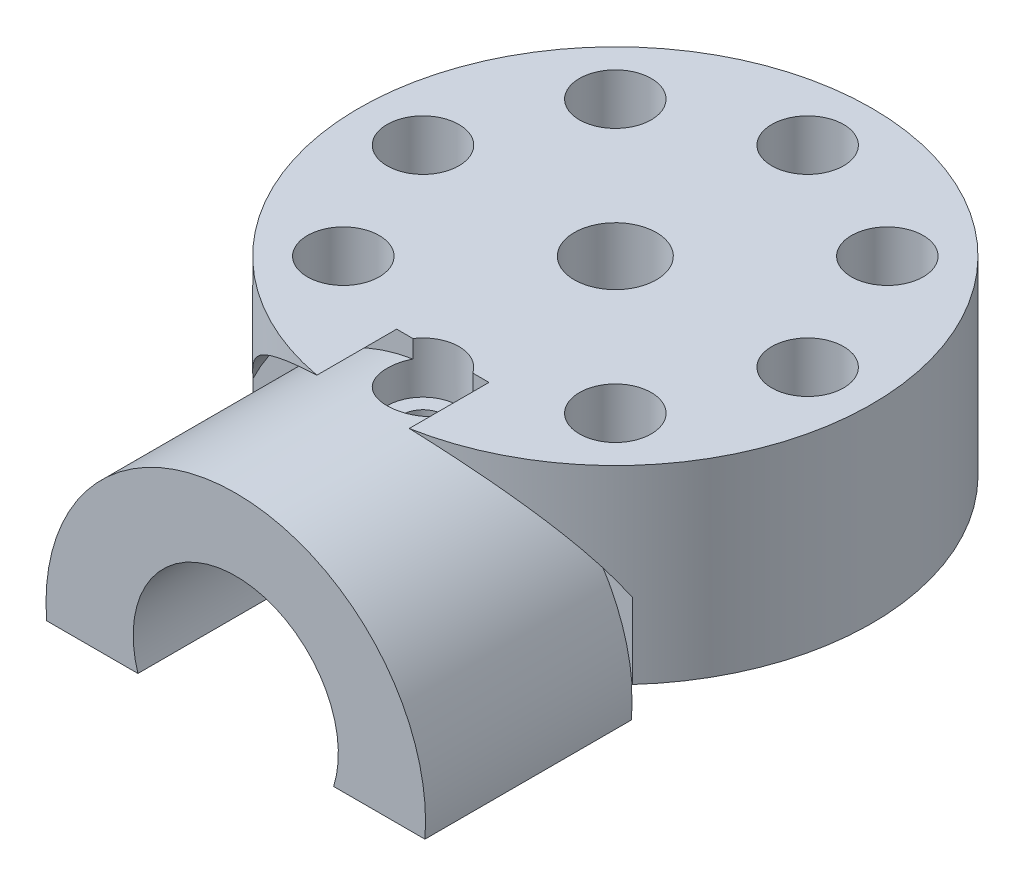
from build123d import *
from build123d.topology import SkipClean

# Parameters (mm, degrees)
EXTRUDE_2_DEPTH     = 18.5
EXTRUDE_3_DEPTH     = 37
SKETCH_7_R          = 4
SKETCH_7_R_2        = 2
CUT_EXTRUDE_1_DEPTH = 49.33477026
EXTRUDE_START       = -20.118057
EXTRUDE_5_DEPTH     = 20.118057
SKETCH_9_R          = 25
CUT_EXTRUDE_2_DEPTH = 3
CUT_EXTRUDE_3_REACH = 54.113
SKETCH_10_R         = 20.5
SKETCH_10_R_2       = 18.5
SKETCH_11_R         = 3.5
CUT_EXTRUDE_4_DEPTH = 5
CUT_EXTRUDE_5_DEPTH = 3
SKETCH_13_R         = 10
CUT_EXTRUDE_7_DEPTH = 47.821469602


with BuildPart() as part:
    # 草图1 → 凸台-拉伸2 (new body)
    with BuildSketch(Plane(origin=(0, 0, 0), x_dir=(1, 0, 0), z_dir=(0, 1, 0))):
        with BuildLine():
            ThreePointArc((0, 25), (-17.67766953, 17.67766953), (-25, 0))
            ThreePointArc((-25, 0), (-17.67766953, -17.67766953), (0, -25))
            ThreePointArc((0, -25), (17.67766953, -17.67766953), (25, 0))
            ThreePointArc((25, 0), (17.67766953, 17.67766953), (0, 25))
        make_face()
    extrude(amount=EXTRUDE_2_DEPTH)

    # 草图4 → 凸台-拉伸3 (add)
    with BuildSketch(Plane.XY):
        with BuildLine():
            Line((-18.439088915, 0), (18.439088915, 0))
            ThreePointArc((18.439088915, 0), (0, 17), (-18.439088915, 0))
        make_face()
    extrude(amount=EXTRUDE_3_DEPTH)

    # 草图7 → 切除-拉伸1 (cut, through all)
    with BuildSketch(Plane.XZ):
        with Locations(Location((0, 0, 0), (0, 0, 270))):
            Circle(SKETCH_7_R)
        with Locations(Location((18.75, 0, 0), (0, 0, 270))):
            Circle(SKETCH_7_R_2)
        with Locations(Location((13.258252147, 13.258252147, 0), (0, 0, 270))):
            Circle(SKETCH_7_R_2)
        with Locations(Location((0, 18.75, 0), (0, 0, 90))):
            Circle(SKETCH_7_R_2)
        with Locations(Location((-18.75, 0, 0), (0, 0, 90))):
            Circle(SKETCH_7_R_2)
        with Locations(Location((-13.258252147, 13.258252147, 0), (0, 0, 90))):
            Circle(SKETCH_7_R_2)
        with Locations(Location((13.258252147, -13.258252147, 0), (0, 0, 90))):
            Circle(SKETCH_7_R_2)
        with Locations(Location((0, -18.75, 0), (0, 0, 270))):
            Circle(SKETCH_7_R_2)
        with Locations(Location((-13.258252147, -13.258252147, 0), (0, 0, 270))):
            Circle(SKETCH_7_R_2)
    extrude(amount=-CUT_EXTRUDE_1_DEPTH, mode=Mode.SUBTRACT)

    # 草图8 → 凸台-拉伸5 (add)
    with SkipClean():  # the faces are left unmerged after this step: merging them gives an invalid solid
        with BuildSketch(Plane.XY.offset(37).offset(EXTRUDE_START)):
            with BuildLine():
                Line((-18.439088915, 0), (18.439088915, 0))
                ThreePointArc((18.439088915, 0), (18.5, -1.5), (18.439088915, -3))
                Line((18.439088915, -3), (-18.439088915, -3))
                ThreePointArc((-18.439088915, -3), (-18.5, -1.5), (-18.439088915, 0))
            make_face()
        extrude(amount=EXTRUDE_5_DEPTH)

    # 草图9 → 切除-拉伸2 (cut)
    with SkipClean():  # the faces are left unmerged after this step: merging them gives an invalid solid
        with BuildSketch(Plane.XZ.offset(3)):
            with Locations(Location((0, 0, 0), (0, 0, 137.524279479))):
                Circle(SKETCH_9_R)
        extrude(amount=-CUT_EXTRUDE_2_DEPTH, mode=Mode.SUBTRACT)

    # 切除-拉伸3: up to this face of the body (flat: up to its plane)
    cut_extrude_3_end = Plane(part.part.faces().sort_by_distance((0, 7.168233696, 37))[0])
    # 草图10 → 切除-拉伸3 (cut, up to the picked face)
    with BuildSketch(Plane.XY.offset(16.815171721), mode=Mode.PRIVATE) as cut_extrude_3_sk1:
        with Locations((0, -1.5)):
            Circle(SKETCH_10_R)
        with Locations((0, -1.5)):
            Circle(SKETCH_10_R_2, mode=Mode.SUBTRACT)
    cut_extrude_3_tool1 = split(extrude(cut_extrude_3_sk1.sketch, amount=CUT_EXTRUDE_3_REACH, mode=Mode.PRIVATE), bisect_by=cut_extrude_3_end, keep=Keep.BOTH, mode=Mode.PRIVATE)
    add(cut_extrude_3_tool1.solids().sort_by(Axis((-19.920172, -1.5, 16.815172), (0, 0, 1)))[0], mode=Mode.SUBTRACT)

    # 草图11 → 切除-拉伸4 (cut)
    with SkipClean():  # the faces are left unmerged after this step: merging them gives an invalid solid
        with BuildSketch(Plane(origin=(0, 18.5, 0), x_dir=(1, 0, 0), z_dir=(0, 1, 0))):
            with Locations(Location((0, 18.75, 0), (0, 0, 270))):
                Circle(SKETCH_11_R)
            with Locations(Location((13.258252147, 13.258252147, 0), (0, 0, 270))):
                Circle(SKETCH_11_R)
            with Locations(Location((18.75, 0, 0), (0, 0, 270))):
                Circle(SKETCH_11_R)
            with Locations(Location((13.258252147, -13.258252147, 0), (0, 0, 270))):
                Circle(SKETCH_11_R)
            with Locations(Location((0, -18.75, 0), (0, 0, 270))):
                Circle(SKETCH_11_R)
            with Locations(Location((-13.258252147, -13.258252147, 0), (0, 0, 270))):
                Circle(SKETCH_11_R)
            with Locations(Location((-18.75, 0, 0), (0, 0, 270))):
                Circle(SKETCH_11_R)
            with Locations(Location((-13.258252147, 13.258252147, 0), (0, 0, 270))):
                Circle(SKETCH_11_R)
        extrude(amount=-CUT_EXTRUDE_4_DEPTH, mode=Mode.SUBTRACT)

    # 草图12 → 切除-拉伸5 (cut)
    with SkipClean():  # the faces are left unmerged after this step: merging them gives an invalid solid
        with BuildSketch(Plane.XZ):
            Polygon((0, 22), (-2.814582562, 20.375), (-2.814582562, 17.125), (0, 15.5), (2.814582562, 17.125), (2.814582562, 20.375), align=None)
            Polygon((12.417090251, 16.397511083), (15.556349186, 15.556349186), (16.397511083, 12.417090251), (14.099414044, 10.118993212), (10.960155108, 10.960155108), (10.118993212, 14.099414044), align=None)
            Polygon((-15.556349186, 15.556349186), (-16.397511083, 12.417090251), (-14.099414044, 10.118993212), (-10.960155108, 10.960155108), (-10.118993212, 14.099414044), (-12.417090251, 16.397511083), align=None)
            Polygon((16.397511083, -12.417090251), (15.556349186, -15.556349186), (12.417090251, -16.397511083), (10.118993212, -14.099414044), (10.960155108, -10.960155108), (14.099414044, -10.118993212), align=None)
            Polygon((20.375, 2.814582562), (22, 0), (20.375, -2.814582562), (17.125, -2.814582562), (15.5, 0), (17.125, 2.814582562), align=None)
            Polygon((-17.125, 2.814582562), (-15.5, 0), (-17.125, -2.814582562), (-20.375, -2.814582562), (-22, 0), (-20.375, 2.814582562), align=None)
            Polygon((0, -22), (2.814582562, -20.375), (2.814582562, -17.125), (0, -15.5), (-2.814582562, -17.125), (-2.814582562, -20.375), align=None)
            Polygon((-15.556349186, -15.556349186), (-12.417090251, -16.397511083), (-10.118993212, -14.099414044), (-10.960155108, -10.960155108), (-14.099414044, -10.118993212), (-16.397511083, -12.417090251), align=None)
        extrude(amount=-CUT_EXTRUDE_5_DEPTH, mode=Mode.SUBTRACT)

    # 草图13 → 切除-拉伸7 (cut, through all)
    with SkipClean():  # the faces are left unmerged after this step: merging them gives an invalid solid
        with BuildSketch(Plane.XY.offset(10)):
            Circle(SKETCH_13_R)
        extrude(amount=CUT_EXTRUDE_7_DEPTH, mode=Mode.SUBTRACT)


solid = part.part
